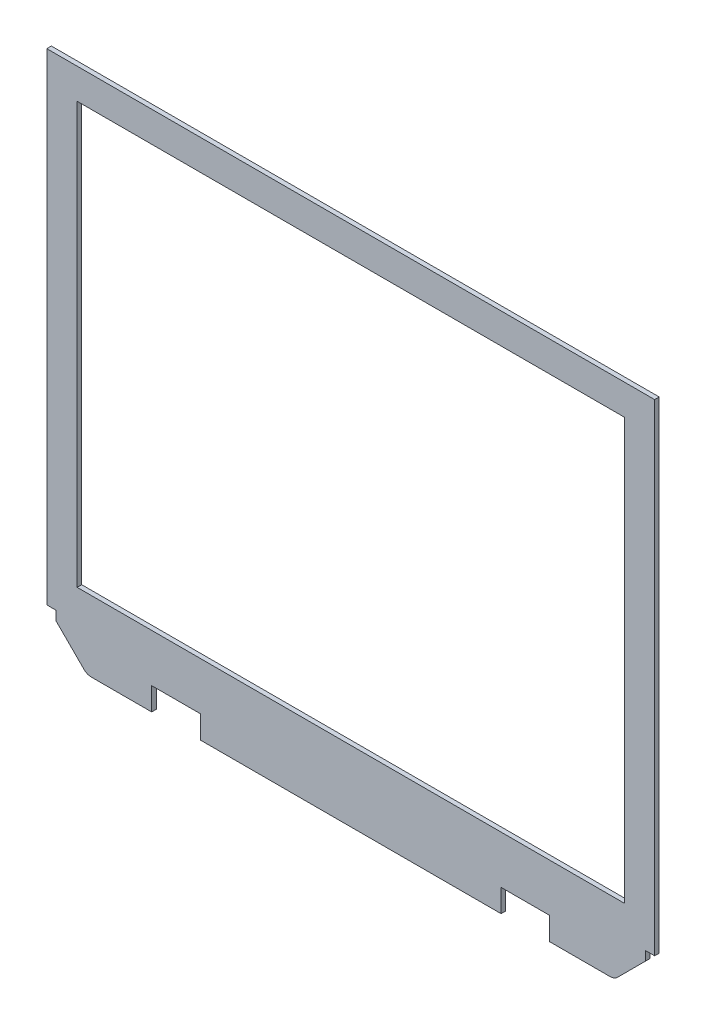
from build123d import *

# Parameters (mm, degrees)
SKETCH1_W           = 400
SKETCH1_H           = 317
SKETCH1_W_2         = 360
SKETCH1_H_2         = 277
BOSS_EXTRUDE1_DEPTH = 3
BOSS_EXTRUDE4_DEPTH = 3


with BuildPart() as part:
    # Sketch1 → Boss-Extrude1 (new body)
    with BuildSketch(Plane.XY):
        Rectangle(SKETCH1_W, SKETCH1_H)
        Rectangle(SKETCH1_W_2, SKETCH1_H_2, mode=Mode.SUBTRACT)
    extrude(amount=BOSS_EXTRUDE1_DEPTH)

    # Sketch2 → Boss-Extrude4 (add, through all)
    with BuildSketch(Plane.XY.offset(3)):
        with BuildLine():
            Line((-98.955345629, -185), (0, -185))
            Line((0, -185), (0, -158.5))
            Line((0, -158.5), (-194, -158.5))
            Line((-194, -158.5), (-194, -164.5))
            Line((-194, -164.5), (-175.383585865, -183.116414135))
            ThreePointArc((-175.383585865, -183.116414135), (-173.093720589, -184.544378238), (-170.433838397, -185))
            Line((-170.433838397, -185), (-130.955345629, -185))
            Line((-130.955345629, -185), (-130.955345629, -170))
            Line((-130.955345629, -170), (-98.955345629, -170))
            Line((-98.955345629, -170), (-98.955345629, -185))
        make_face()
        with BuildLine():
            Line((130.955345629, -170), (130.955345629, -185))
            Line((130.955345629, -185), (170.433838397, -185))
            ThreePointArc((170.433838397, -185), (173.093720589, -184.544378238), (175.383585865, -183.116414135))
            Line((175.383585865, -183.116414135), (194, -164.5))
            Line((194, -164.5), (194, -158.5))
            Line((194, -158.5), (0, -158.5))
            Line((0, -158.5), (0, -185))
            Line((0, -185), (98.955345629, -185))
            Line((98.955345629, -185), (98.955345629, -170))
            Line((98.955345629, -170), (130.955345629, -170))
        make_face()
    extrude(amount=-BOSS_EXTRUDE4_DEPTH)


solid = part.part
